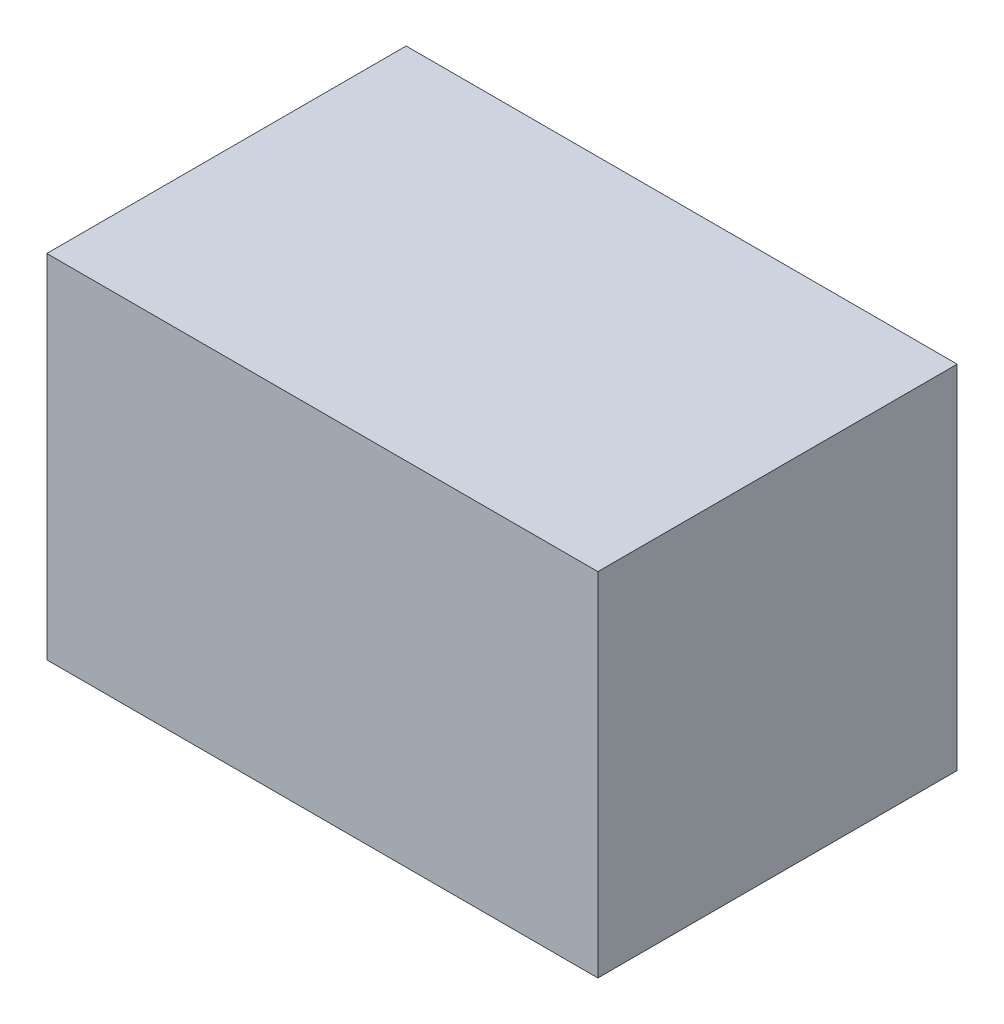
from build123d import *

# Parameters (mm, degrees)
SKETCH1_W           = 151.13
SKETCH1_H           = 98.552
BOSS_EXTRUDE1_DEPTH = 96.52


with BuildPart() as part:
    # Sketch1 → Boss-Extrude1 (new body)
    with BuildSketch(Plane(origin=(0, 0, 0), x_dir=(1, 0, 0), z_dir=(0, 1, 0))):
        Rectangle(SKETCH1_W, SKETCH1_H)
    extrude(amount=BOSS_EXTRUDE1_DEPTH)


solid = part.part
